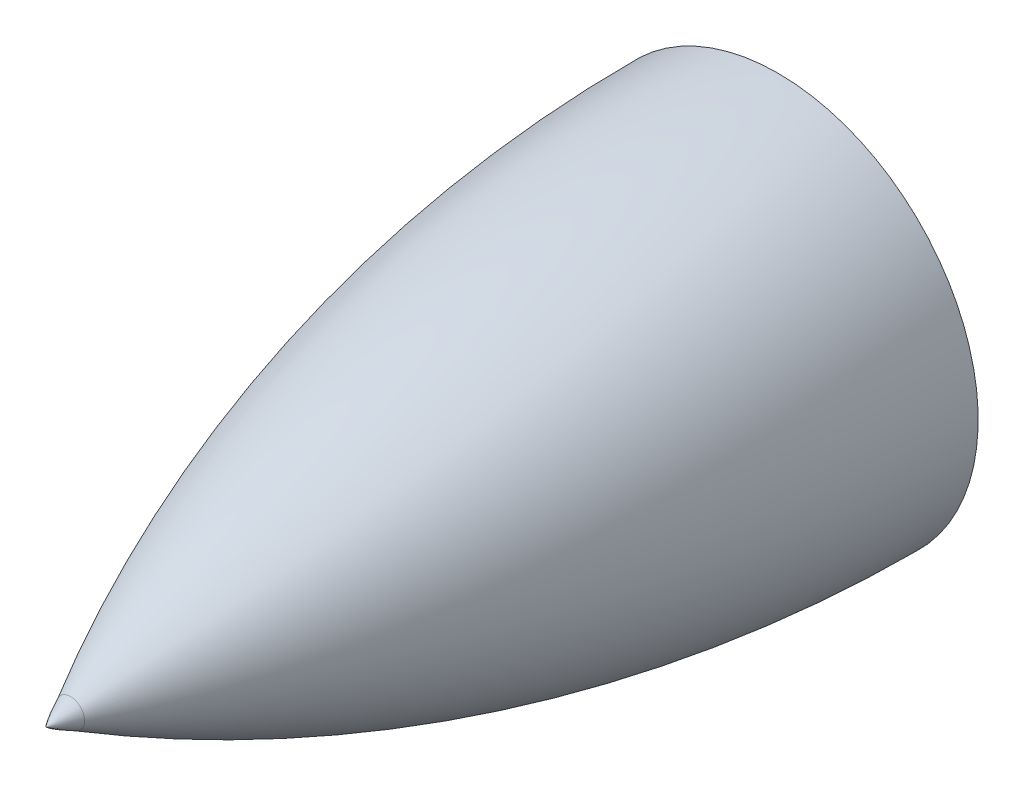
from build123d import *


with BuildPart() as part:
    # Sketch1 → Revolve1 (revolve)
    with BuildSketch(Plane(origin=(0, 0, 0), x_dir=(0, 0, -1), z_dir=(1, 0, 0))):
        with BuildLine():
            Line((0, 293.390243902), (0, 294.890243902))
            ThreePointArc((0, 294.890243902), (-77.751205778, 284.455630897), (-150, 253.890243902))
            Line((-150, 253.890243902), (-144.012702692, 253.890243902))
            ThreePointArc((-144.012702692, 253.890243902), (-90.809500367, 277.405027223), (-34, 289.90328471))
            Line((-34, 289.90328471), (-34, 291.413512413))
            ThreePointArc((-34, 291.413512413), (-17.02870714, 292.89564413), (0, 293.390243902))
        make_face()
    revolve(axis=Axis((0, 253.890243902, 0), (0, 0, 1)))

    # Sketch2 → Cut-Revolve1 (revolve, cut)
    with BuildSketch(Plane(origin=(0, 0, 0), x_dir=(0, 0, -1), z_dir=(1, 0, 0)), mode=Mode.PRIVATE) as cut_revolve1_sk:
        with BuildLine():
            Line((-150, 253.890243902), (-145, 253.890243902))
            Line((-145, 253.890243902), (-145, 256.778612717))
            ThreePointArc((-145, 256.778612717), (-147.507069894, 255.346666867), (-150, 253.890243902))
        make_face()
    revolve(cut_revolve1_sk.sketch.rotate(Axis((0, 253.890243902, 150), (0, 0, -1)), 180), axis=Axis((0, 253.890243902, 150), (0, 0, -1)), mode=Mode.SUBTRACT)

    # Sketch4 → Revolve2 (revolve)
    with BuildSketch(Plane(origin=(0, 0, 0), x_dir=(0, 0, -1), z_dir=(1, 0, 0)), mode=Mode.PRIVATE) as revolve2_sk:
        with BuildLine():
            Line((-145, 253.890243902), (-150, 253.890243902))
            add(Edge.make_bspline(
                [(-145, 256.778612717), (-148.366651087, 255.18669062), (-150, 254.065514025), (-150, 253.890243902)],
                knots=[0, 0, 0, 0, 0.5, 0.5, 0.5, 0.5], degree=3))
            Line((-145, 256.778612717), (-145, 253.890243902))
        make_face()
    revolve(revolve2_sk.sketch.rotate(Axis((0, 253.890243902, 145), (0, 0, 1)), 180), axis=Axis((0, 253.890243902, 145), (0, 0, 1)))


solid = part.part
